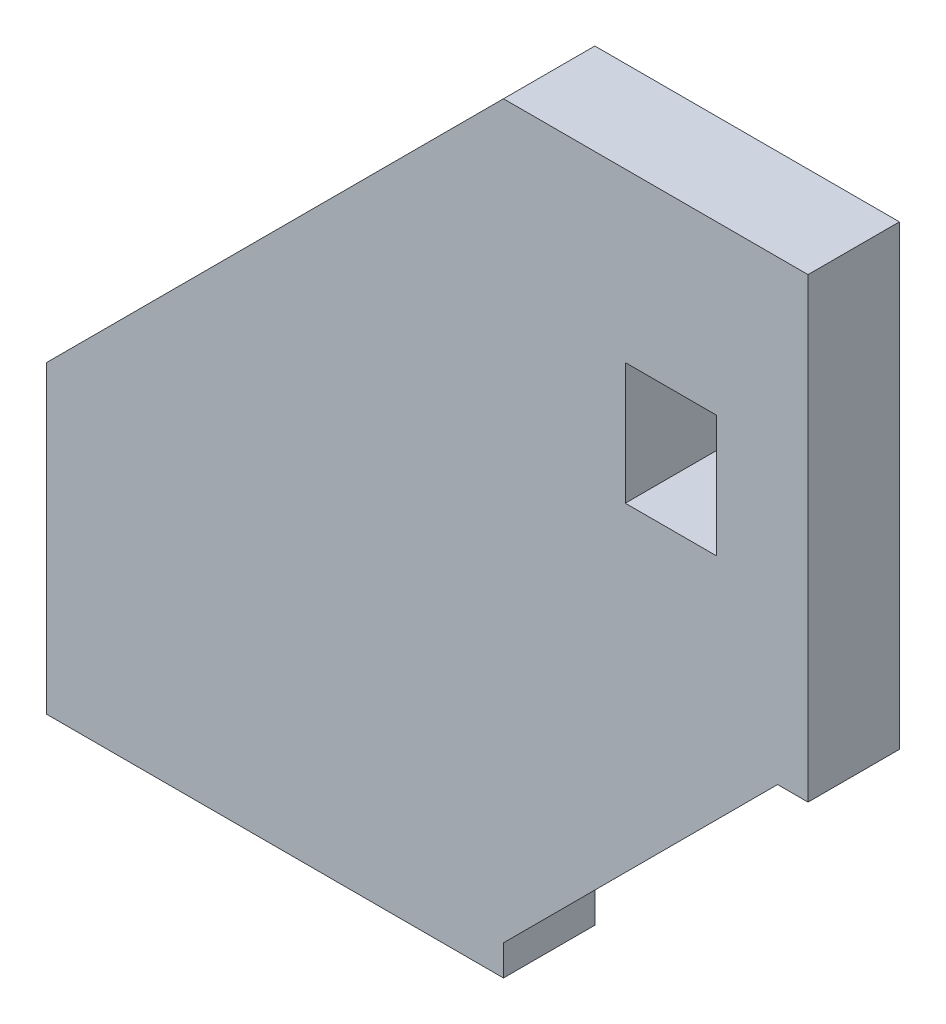
from build123d import *

# Parameters (mm, degrees)
BOSS_EXTRUDE1_DEPTH = 0.15
SKETCH2_W           = 0.3
SKETCH2_H           = 0.4
CUT_EXTRUDE1_DEPTH  = 3.930870178


with BuildPart() as part:
    # Sketch1 → Boss-Extrude1 (new, symmetric)
    with BuildSketch(Plane.XY):
        Polygon((0, 0), (0, 1.5), (-1, 1.5), (-2.5, 0), (-2.5, -1), (-1, -1), (-1, -0.9), (-0.1, 0), align=None)
    extrude(amount=BOSS_EXTRUDE1_DEPTH, both=True)

    # Sketch2 → Cut-Extrude1 (cut, through all)
    with BuildSketch(Plane.XY.offset(0.15)):
        with Locations((-0.45, 0.75)):
            Rectangle(SKETCH2_W, SKETCH2_H)
    extrude(amount=-CUT_EXTRUDE1_DEPTH, mode=Mode.SUBTRACT)


solid = part.part
